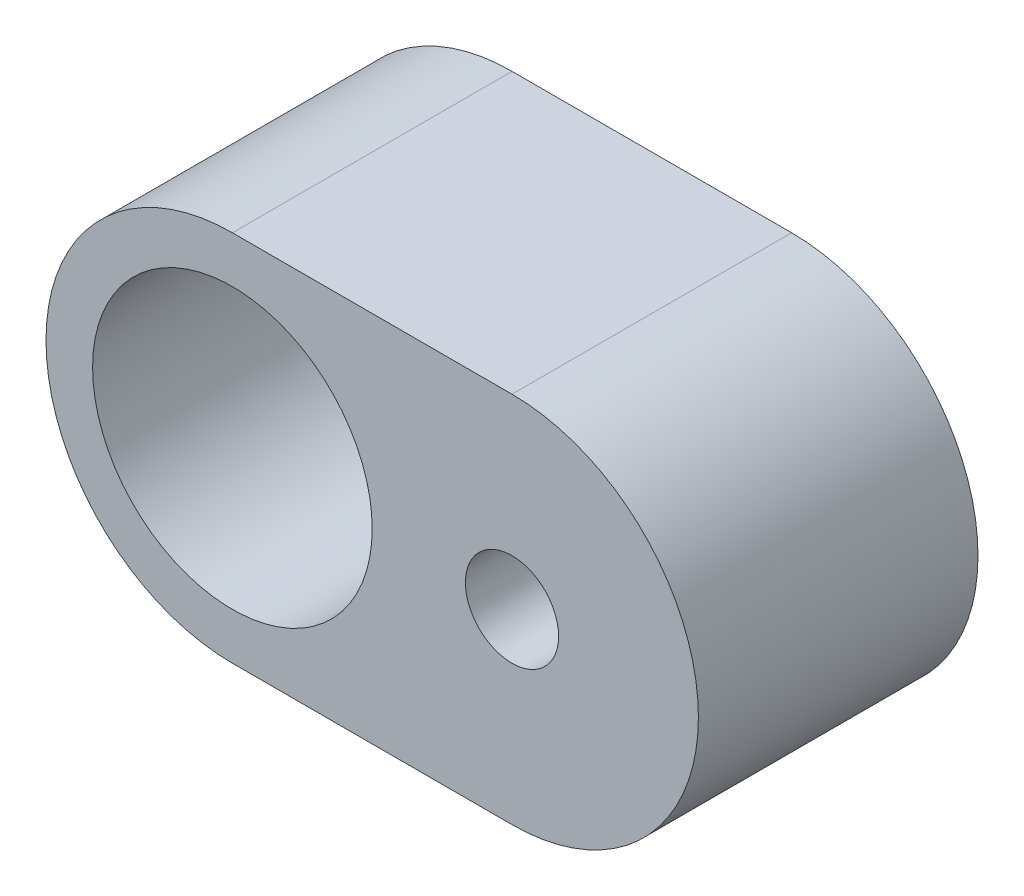
from build123d import *

# Parameters (mm, degrees)
BOSS_EXTRUDE1_DEPTH = 30
SKETCH2_R           = 15
SKETCH2_R_2         = 5
CUT_EXTRUDE1_DEPTH  = 62.64414003


with BuildPart() as part:
    # Sketch1 → Boss-Extrude1 (new body)
    with BuildSketch(Plane.XY):
        with BuildLine():
            Line((-30, 20), (0, 20))
            ThreePointArc((0, 20), (20, 0), (0, -20))
            Line((0, -20), (-30, -20))
            ThreePointArc((-30, -20), (-50, 0), (-30, 20))
        make_face()
    extrude(amount=BOSS_EXTRUDE1_DEPTH)

    # Sketch2 → Cut-Extrude1 (cut, through all)
    with BuildSketch(Plane.XY):
        with Locations((-30, 0)):
            Circle(SKETCH2_R)
        Circle(SKETCH2_R_2)
    extrude(amount=CUT_EXTRUDE1_DEPTH, mode=Mode.SUBTRACT)


solid = part.part
